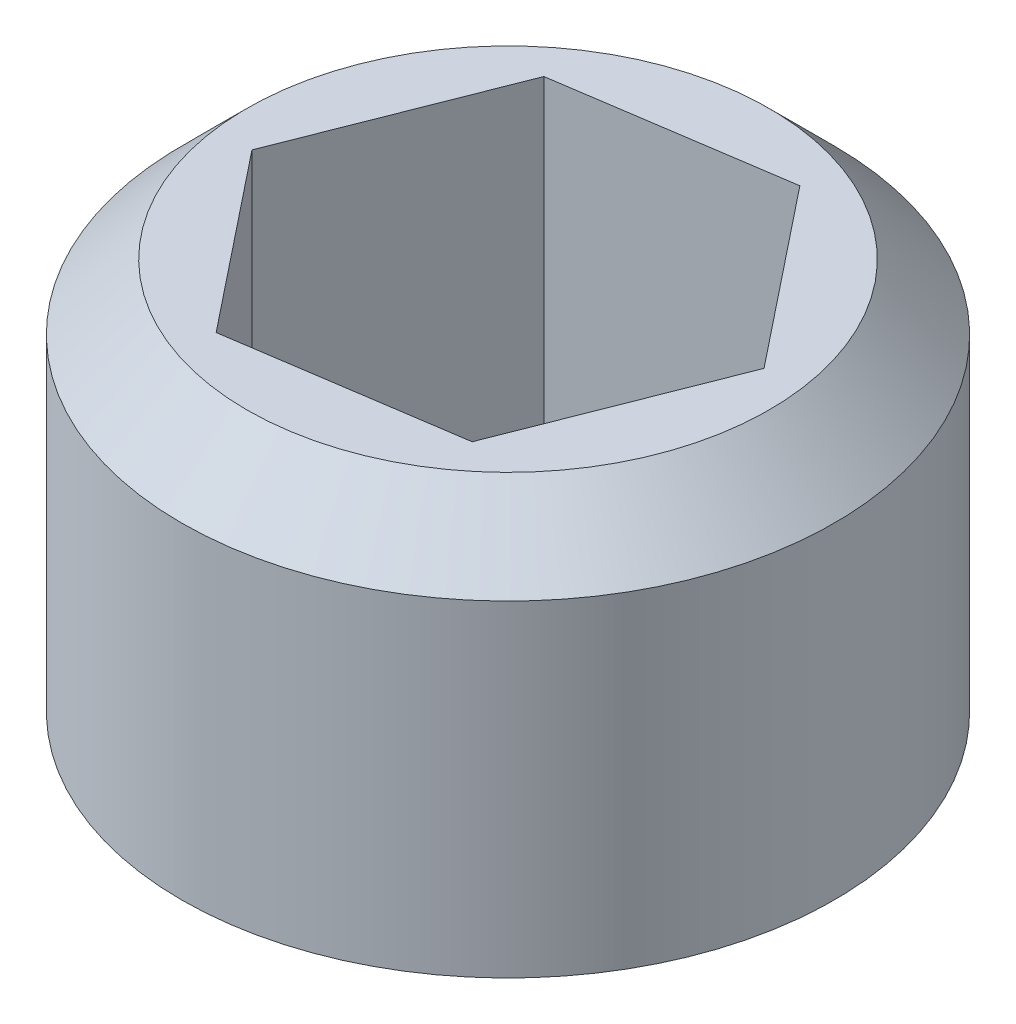
from build123d import *

# Parameters (mm, degrees)
SKETCH_1_R          = 5
EXTRUDE_1_DEPTH     = 6
CUT_EXTRUDE_1_DEPTH = 5
CHAMFER_1_SIZE      = 1


with BuildPart() as part:
    # 草图1 → 凸台-拉伸1 (new body)
    with BuildSketch(Plane(origin=(0, 0, 0), x_dir=(1, 0, 0), z_dir=(0, 1, 0))):
        with Locations(Location((0, 0, 0), (0, 0, 270))):
            Circle(SKETCH_1_R)
    extrude(amount=EXTRUDE_1_DEPTH)

    # 草图2 → 切除-拉伸1 (cut)
    with BuildSketch(Plane(origin=(0, 6, 0), x_dir=(1, 0, 0), z_dir=(0, 1, 0))):
        Polygon((1.261535508, 3.20868814), (-2.148037688, 2.696865868), (-3.409573196, -0.511822272), (-1.261535508, -3.20868814), (2.148037688, -2.696865868), (3.409573196, 0.511822272), align=None)
    extrude(amount=-CUT_EXTRUDE_1_DEPTH, mode=Mode.SUBTRACT)

    # 倒角1
    chamfer_1_edges = [part.edges().sort_by_distance(p)[0] for p in [
        (0, 6, -5),
    ]]
    chamfer(chamfer_1_edges, length=CHAMFER_1_SIZE)


solid = part.part
